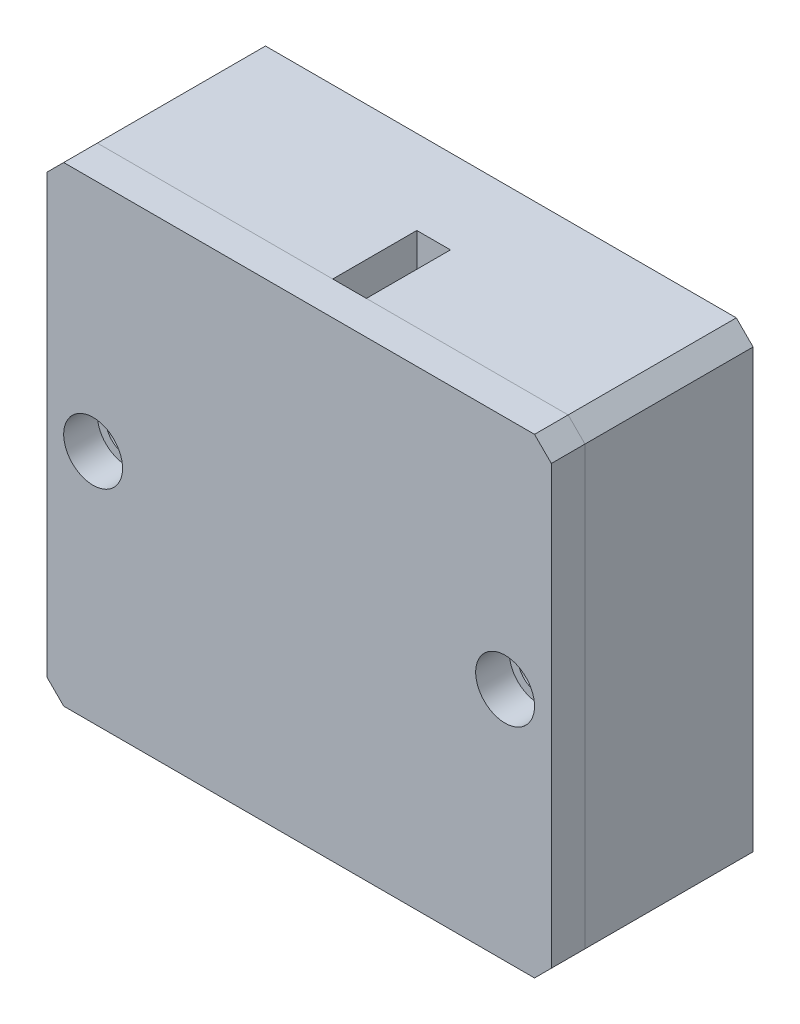
from build123d import *

# Parameters (mm, degrees)
SKETCH1_W           = 30
SKETCH1_H           = 28
BOSS_EXTRUDE1_DEPTH = 10
CUT_EXTRUDE1_DEPTH  = 5
SKETCH3_R           = 1.5
SKETCH3_W           = 19
SKETCH3_H           = 9
CUT_EXTRUDE2_DEPTH  = 3
CHAMFER1_SIZE       = 1
SKETCH4_R           = 1.25
CUT_EXTRUDE3_DEPTH  = 8
BOSS_EXTRUDE2_DEPTH = 2
SKETCH6_R           = 1.75
CUT_EXTRUDE4_DEPTH  = 2
SKETCH7_W           = 18
SKETCH7_H           = 23
BOSS_EXTRUDE3_DEPTH = 2


with BuildPart() as part:
    # Sketch1 → Boss-Extrude1 (new body)
    with BuildSketch(Plane.XY):
        Rectangle(SKETCH1_W, SKETCH1_H)
    extrude(amount=BOSS_EXTRUDE1_DEPTH)

    # Sketch2 → Cut-Extrude1 (cut)
    with BuildSketch(Plane.XY.offset(10)):
        Polygon((0, 14), (0, 12), (-9.5, 12), (-9.5, -14), (9.5, -14), (9.5, 12), (2, 12), (2, 14), align=None)
    extrude(amount=-CUT_EXTRUDE1_DEPTH, mode=Mode.SUBTRACT)

    # Sketch3 → Cut-Extrude2 (cut)
    with BuildSketch(Plane.XY.offset(5)):
        with Locations((1, 10.881966011)):
            Circle(SKETCH3_R)
        with Locations((0, -9.5)):
            Rectangle(SKETCH3_W, SKETCH3_H)
    extrude(amount=-CUT_EXTRUDE2_DEPTH, mode=Mode.SUBTRACT)

    # Chamfer1
    chamfer1_edges = [part.edges().sort_by_distance(p)[0] for p in [
        (15, -14, 5),
        (-15, -14, 5),
        (-15, 14, 5),
        (15, 14, 5),
    ]]
    chamfer(chamfer1_edges, length=CHAMFER1_SIZE)

    # Sketch4 → Cut-Extrude3 (cut)
    with BuildSketch(Plane.XY.offset(10)):
        with Locations((-12.25, 0)):
            Circle(SKETCH4_R)
        with Locations(Location((12.25, 0, 0), (0, 0, 180))):
            Circle(SKETCH4_R)
    extrude(amount=-CUT_EXTRUDE3_DEPTH, mode=Mode.SUBTRACT)


with BuildPart() as body_2:
    # Sketch5 → Boss-Extrude2 (new body)
    with BuildSketch(Plane.XY.offset(10)):
        Polygon((-14, 14), (-15, 13), (-15, -13), (-14, -14), (14, -14), (15, -13), (15, 13), (14, 14), align=None)
    extrude(amount=BOSS_EXTRUDE2_DEPTH)

    # Sketch6 → Cut-Extrude4 (cut)
    with BuildSketch(Plane.XY.offset(12)):
        with Locations((-12.25, 0)):
            Circle(SKETCH6_R)
        with Locations((12.25, 0)):
            Circle(SKETCH6_R)
    extrude(amount=-CUT_EXTRUDE4_DEPTH, mode=Mode.SUBTRACT)

    # Sketch7 → Boss-Extrude3 (add)
    with BuildSketch(Plane(origin=(0, 0, 10), x_dir=(-1, 0, 0), z_dir=(0, 0, -1))):
        with Locations((0, -2.5)):
            Rectangle(SKETCH7_W, SKETCH7_H)
    extrude(amount=BOSS_EXTRUDE3_DEPTH)


solid = Compound([part.part, body_2.part])
